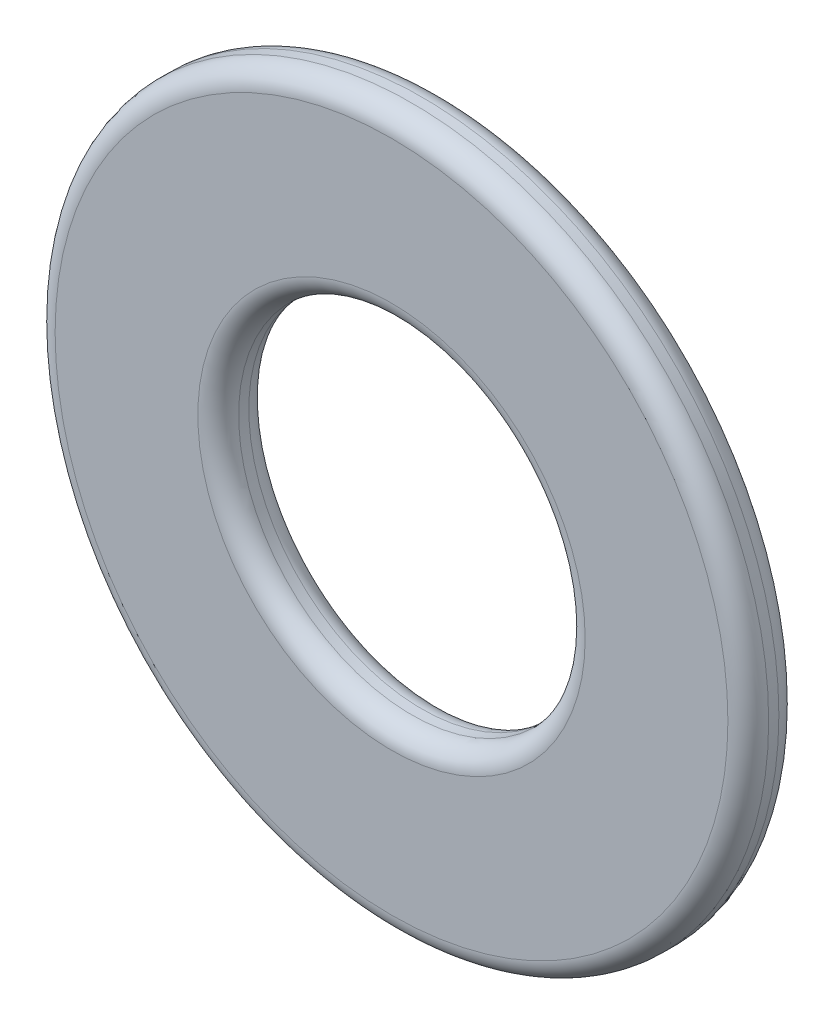
from build123d import *

# Parameters (mm, degrees)
ESBO_O1_R                = 3.5
ESBO_O1_R_2              = 1.7
RESSALTO_EXTRUS_O1_DEPTH = 0.5
FILETE1_R                = 0.2


with BuildPart() as part:
    # Esboço1 → Ressalto-extrusão1 (new body)
    with BuildSketch(Plane.XY):
        Circle(ESBO_O1_R)
        Circle(ESBO_O1_R_2, mode=Mode.SUBTRACT)
    extrude(amount=RESSALTO_EXTRUS_O1_DEPTH)

    # Filete1
    filete1_edges = [part.edges().sort_by_distance(p)[0] for p in [
        (-3.5, 0, 0),
        (-3.5, 0, 0.5),
        (-1.7, 0, 0),
        (-1.7, 0, 0.5),
    ]]
    fillet(filete1_edges, radius=FILETE1_R)


solid = part.part
